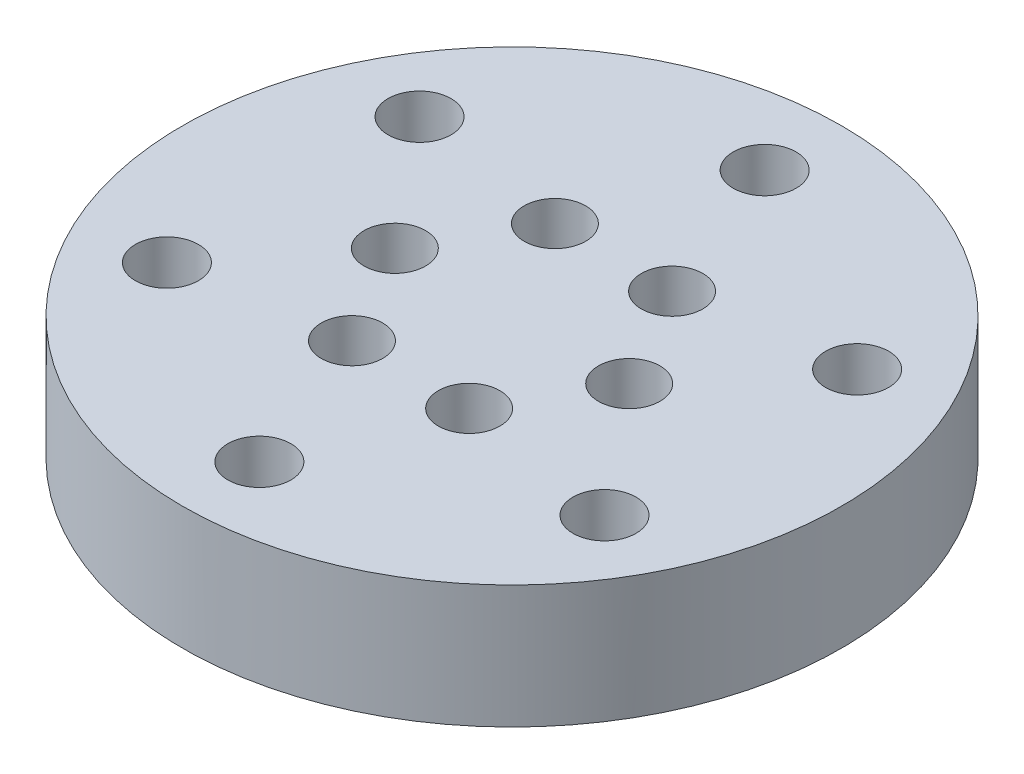
from build123d import *

# Parameters (mm, degrees)
SKETCH_1_R          = 22.5
SKETCH_1_R_2        = 2.15
EXTRUDE_1_DEPTH     = 10.4
SKETCH_3_R          = 4
SKETCH_3_R_2        = 2.15
CUT_EXTRUDE_1_DEPTH = 5
SKETCH_4_R          = 2.1
CUT_EXTRUDE_2_DEPTH = 34.476260245
SKETCH_6_R          = 22.5
CUT_EXTRUDE_3_DEPTH = 2


with BuildPart() as part:
    # 草图1 → 凸台-拉伸1 (new body)
    with BuildSketch(Plane(origin=(0, 0, 0), x_dir=(1, 0, 0), z_dir=(0, 1, 0))):
        with Locations(Location((0, 0, 0), (0, 0, 270))):
            Circle(SKETCH_1_R)
        with Locations(Location((0, 17.25, 0), (0, 0, 270))):
            Circle(SKETCH_1_R_2, mode=Mode.SUBTRACT)
        with Locations(Location((14.938938215, 8.625, 0), (0, 0, 270))):
            Circle(SKETCH_1_R_2, mode=Mode.SUBTRACT)
        with Locations(Location((14.938938215, -8.625, 0), (0, 0, 270))):
            Circle(SKETCH_1_R_2, mode=Mode.SUBTRACT)
        with Locations(Location((0, -17.25, 0), (0, 0, 270))):
            Circle(SKETCH_1_R_2, mode=Mode.SUBTRACT)
        with Locations(Location((-14.938938215, -8.625, 0), (0, 0, 270))):
            Circle(SKETCH_1_R_2, mode=Mode.SUBTRACT)
        with Locations(Location((-14.938938215, 8.625, 0), (0, 0, 270))):
            Circle(SKETCH_1_R_2, mode=Mode.SUBTRACT)
    extrude(amount=EXTRUDE_1_DEPTH)

    # 草图3 → 切除-拉伸1 (cut)
    # profile 1 of 6: a face of its own
    with BuildSketch(Plane.XZ):
        with Locations(Location((0, 17.25, 0), (0, 0, 270))):
            Circle(SKETCH_3_R)
        with Locations(Location((0, 17.25, 0), (0, 0, 270))):
            Circle(SKETCH_3_R_2, mode=Mode.SUBTRACT)
    # profile 2 of 6: a face of its own
    with BuildSketch(Plane.XZ):
        with Locations(Location((14.938938215, 8.625, 0), (0, 0, 270))):
            Circle(SKETCH_3_R)
        with Locations(Location((14.938938215, 8.625, 0), (0, 0, 270))):
            Circle(SKETCH_3_R_2, mode=Mode.SUBTRACT)
    # profile 3 of 6: a face of its own
    with BuildSketch(Plane.XZ):
        with Locations(Location((14.938938215, -8.625, 0), (0, 0, 270))):
            Circle(SKETCH_3_R)
        with Locations(Location((14.938938215, -8.625, 0), (0, 0, 270))):
            Circle(SKETCH_3_R_2, mode=Mode.SUBTRACT)
    # profile 4 of 6: a face of its own
    with BuildSketch(Plane.XZ):
        with Locations(Location((0, -17.25, 0), (0, 0, 270))):
            Circle(SKETCH_3_R)
        with Locations(Location((0, -17.25, 0), (0, 0, 270))):
            Circle(SKETCH_3_R_2, mode=Mode.SUBTRACT)
    # profile 5 of 6: a face of its own
    with BuildSketch(Plane.XZ):
        with Locations(Location((-14.938938215, -8.625, 0), (0, 0, 270))):
            Circle(SKETCH_3_R)
        with Locations(Location((-14.938938215, -8.625, 0), (0, 0, 270))):
            Circle(SKETCH_3_R_2, mode=Mode.SUBTRACT)
    # profile 6 of 6: a face of its own
    with BuildSketch(Plane.XZ):
        with Locations(Location((-14.938938215, 8.625, 0), (0, 0, 270))):
            Circle(SKETCH_3_R)
        with Locations(Location((-14.938938215, 8.625, 0), (0, 0, 270))):
            Circle(SKETCH_3_R_2, mode=Mode.SUBTRACT)
    extrude(amount=-CUT_EXTRUDE_1_DEPTH, mode=Mode.SUBTRACT)

    # 草图4 → 切除-拉伸2 (cut, through all)
    with BuildSketch(Plane.XZ):
        with BuildLine():
            ThreePointArc((5.05, 8.746856578), (2.181346652, 7.97820323), (2.95, 5.109549882))
            Line((2.95, 5.109549882), (5.05, 8.746856578))
        make_face()
        with BuildLine():
            Line((5.05, 8.746856578), (2.95, 5.109549882))
            ThreePointArc((2.95, 5.109549882), (5.05, 5.109549882), (6.1, 6.92820323))
            ThreePointArc((6.1, 6.92820323), (5.818653348, 7.97820323), (5.05, 8.746856578))
        make_face()
        with Locations(Location((8, 0, 0), (0, 0, 270))):
            Circle(SKETCH_4_R)
        with Locations(Location((-4, 6.92820323, 0), (0, 0, 270))):
            Circle(SKETCH_4_R)
        with Locations(Location((-8, 0, 0), (0, 0, 270))):
            Circle(SKETCH_4_R)
        with Locations(Location((-4, -6.92820323, 0), (0, 0, 270))):
            Circle(SKETCH_4_R)
        with Locations(Location((4, -6.92820323, 0), (0, 0, 270))):
            Circle(SKETCH_4_R)
    extrude(amount=-CUT_EXTRUDE_2_DEPTH, mode=Mode.SUBTRACT)

    # 草图6 → 切除-拉伸3 (cut)
    with BuildSketch(Plane.XZ):
        with Locations(Location((0, 0, 0), (0, 0, 270))):
            Circle(SKETCH_6_R)
    extrude(amount=-CUT_EXTRUDE_3_DEPTH, mode=Mode.SUBTRACT)


solid = part.part
